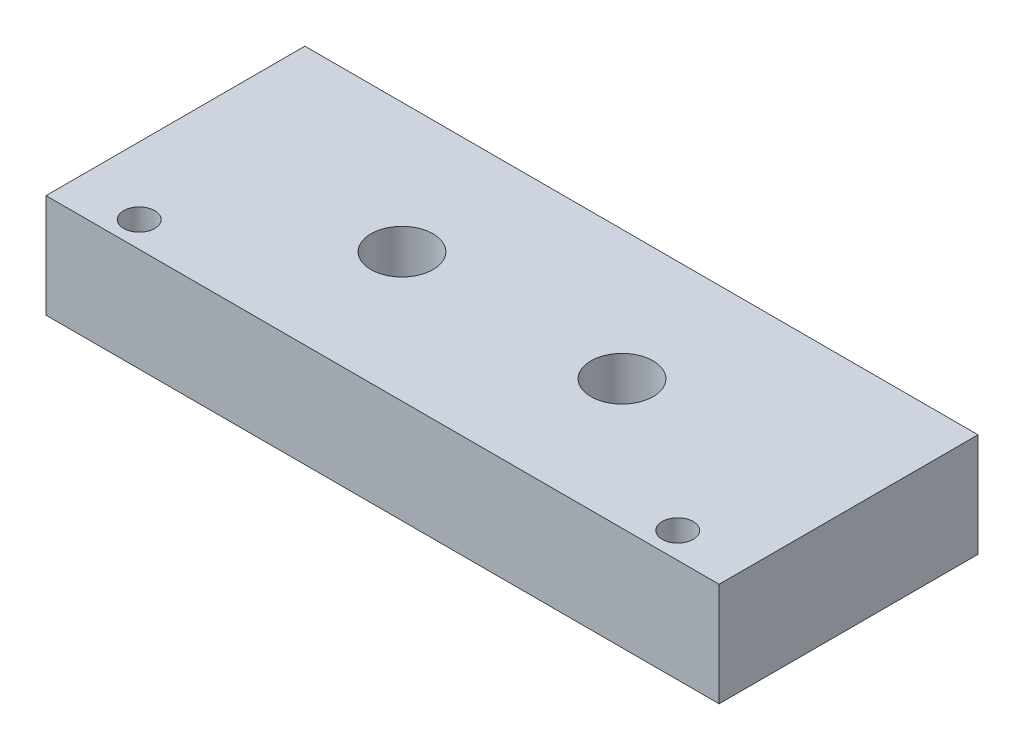
from build123d import *

# Parameters (mm, degrees)
SKETCH_1_W          = 65
SKETCH_1_H          = 25
SKETCH_1_R          = 3
EXTRUDE_1_DEPTH     = 10
SKETCH_2_R          = 1.5
CUT_EXTRUDE_1_DEPTH = 10


with BuildPart() as part:
    # 草图1 → 凸台-拉伸1 (new body)
    with BuildSketch(Plane(origin=(0, 0, 0), x_dir=(1, 0, 0), z_dir=(0, 1, 0))):
        Rectangle(SKETCH_1_W, SKETCH_1_H)
        with Locations(Location((-10.625, 0, 0), (0, 0, 270))):
            Circle(SKETCH_1_R, mode=Mode.SUBTRACT)
        with Locations(Location((10.625, 0, 0), (0, 0, 270))):
            Circle(SKETCH_1_R, mode=Mode.SUBTRACT)
    extrude(amount=EXTRUDE_1_DEPTH)

    # 草图2 → 切除-拉伸1 (cut)
    with BuildSketch(Plane.XZ):
        with Locations(Location((-26, 10, 0), (0, 0, 270))):
            Circle(SKETCH_2_R)
        with Locations(Location((26, 10, 0), (0, 0, 270))):
            Circle(SKETCH_2_R)
    extrude(amount=-CUT_EXTRUDE_1_DEPTH, mode=Mode.SUBTRACT)


solid = part.part
